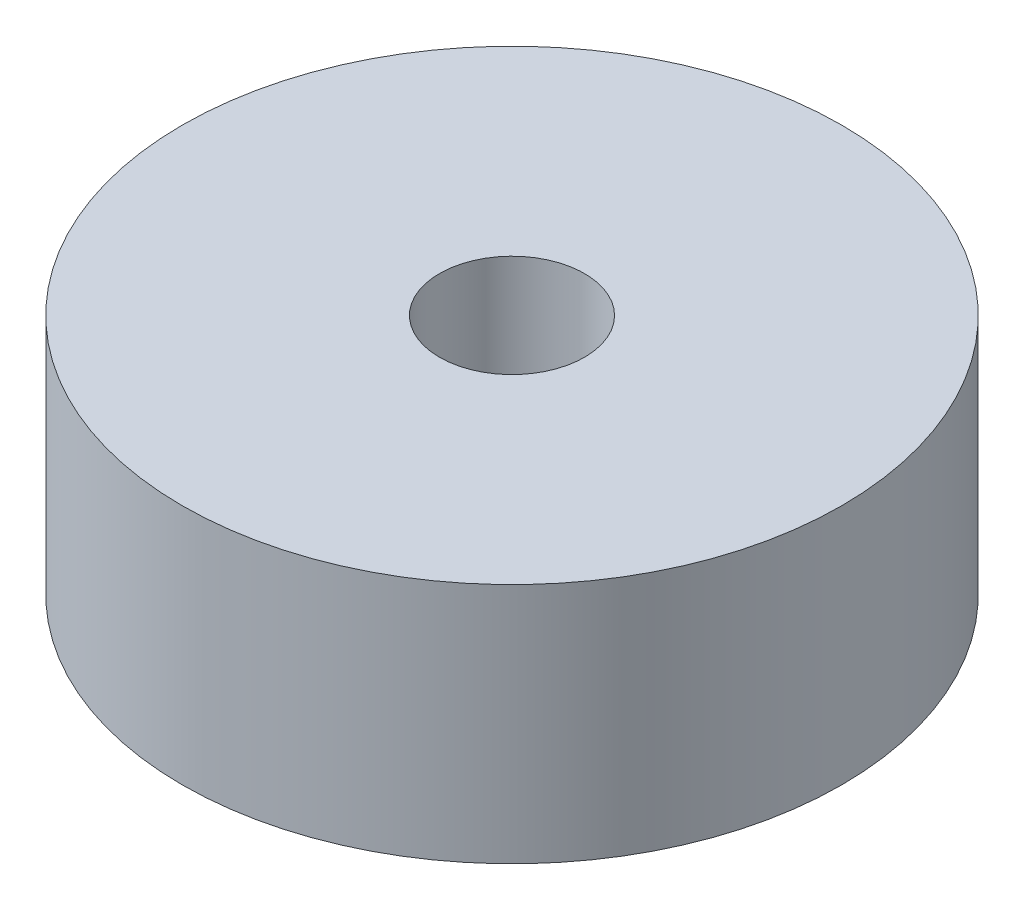
from build123d import *

# Parameters (mm, degrees)
SKIZZE1_R                       = 15
SKIZZE1_R_2                     = 3.3
AUFSATZ_LINEAR_AUSTRAGEN1_DEPTH = 11


with BuildPart() as part:
    # Skizze1 → Aufsatz-Linear austragen1 (new body)
    with BuildSketch(Plane(origin=(0, 0, 0), x_dir=(1, 0, 0), z_dir=(0, 1, 0))):
        with Locations(Location((0, 0, 0), (0, 0, 270))):
            Circle(SKIZZE1_R)
        with Locations(Location((0, 0, 0), (0, 0, 270))):
            Circle(SKIZZE1_R_2, mode=Mode.SUBTRACT)
    extrude(amount=AUFSATZ_LINEAR_AUSTRAGEN1_DEPTH)


solid = part.part
